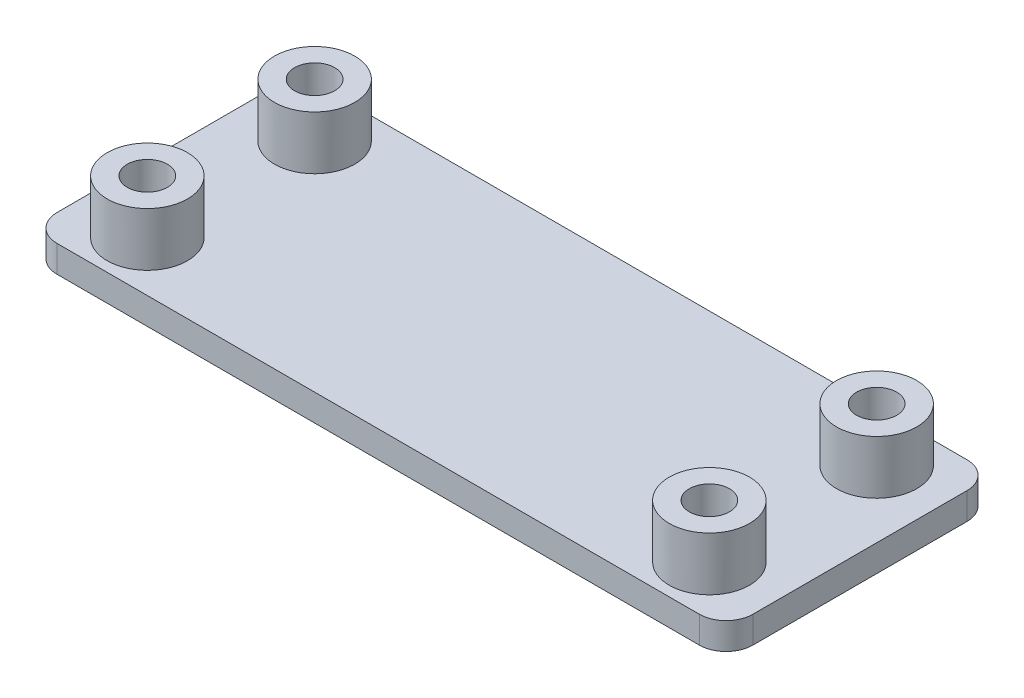
from build123d import *

# Parameters (mm, degrees)
SKETCH1_W           = 52
SKETCH1_H           = 20
BOSS_EXTRUDE1_DEPTH = 2
SKETCH2_R           = 3
SKETCH2_R_2         = 1.5
BOSS_EXTRUDE2_DEPTH = 4
SKETCH3_R           = 1.5
CUT_EXTRUDE1_DEPTH  = 56.856960175
FILLET1_R           = 2


with BuildPart() as part:
    # Sketch1 → Boss-Extrude1 (new body)
    with BuildSketch(Plane(origin=(0, 0, 0), x_dir=(1, 0, 0), z_dir=(0, 1, 0))):
        with Locations((26, 10)):
            Rectangle(SKETCH1_W, SKETCH1_H)
    extrude(amount=BOSS_EXTRUDE1_DEPTH)

    # Sketch2 → Boss-Extrude2 (add)
    # profile 1 of 4: a face of its own
    with BuildSketch(Plane(origin=(0, 2, 0), x_dir=(1, 0, 0), z_dir=(0, 1, 0))):
        with Locations(Location((5, 16.25, 0), (0, 0, 90))):
            Circle(SKETCH2_R)
        with Locations(Location((5, 16.25, 0), (0, 0, 270))):
            Circle(SKETCH2_R_2, mode=Mode.SUBTRACT)
    # profile 2 of 4: a face of its own
    with BuildSketch(Plane(origin=(0, 2, 0), x_dir=(1, 0, 0), z_dir=(0, 1, 0))):
        with Locations(Location((5, 3.75, 0), (0, 0, 90))):
            Circle(SKETCH2_R)
        with Locations(Location((5, 3.75, 0), (0, 0, 270))):
            Circle(SKETCH2_R_2, mode=Mode.SUBTRACT)
    # profile 3 of 4: a face of its own
    with BuildSketch(Plane(origin=(0, 2, 0), x_dir=(1, 0, 0), z_dir=(0, 1, 0))):
        with Locations(Location((47, 3.75, 0), (0, 0, 90))):
            Circle(SKETCH2_R)
        with Locations(Location((47, 3.75, 0), (0, 0, 270))):
            Circle(SKETCH2_R_2, mode=Mode.SUBTRACT)
    # profile 4 of 4: a face of its own
    with BuildSketch(Plane(origin=(0, 2, 0), x_dir=(1, 0, 0), z_dir=(0, 1, 0))):
        with Locations(Location((47, 16.25, 0), (0, 0, 90))):
            Circle(SKETCH2_R)
        with Locations(Location((47, 16.25, 0), (0, 0, 270))):
            Circle(SKETCH2_R_2, mode=Mode.SUBTRACT)
    extrude(amount=BOSS_EXTRUDE2_DEPTH)

    # Sketch3 → Cut-Extrude1 (cut, through all)
    with BuildSketch(Plane(origin=(0, 2, 0), x_dir=(1, 0, 0), z_dir=(0, 1, 0))):
        with Locations(Location((47, 3.75, 0), (0, 0, 270))):
            Circle(SKETCH3_R)
        with Locations(Location((47, 16.25, 0), (0, 0, 270))):
            Circle(SKETCH3_R)
        with Locations(Location((5, 3.75, 0), (0, 0, 270))):
            Circle(SKETCH3_R)
        with Locations(Location((5, 16.25, 0), (0, 0, 270))):
            Circle(SKETCH3_R)
    extrude(amount=-CUT_EXTRUDE1_DEPTH, mode=Mode.SUBTRACT)

    # Fillet1
    fillet1_edges = [part.edges().sort_by_distance(p)[0] for p in [
        (0, 1, -20),
        (52, 1, -20),
        (52, 1, 0),
        (0, 1, 0),
    ]]
    fillet(fillet1_edges, radius=FILLET1_R)


solid = part.part
